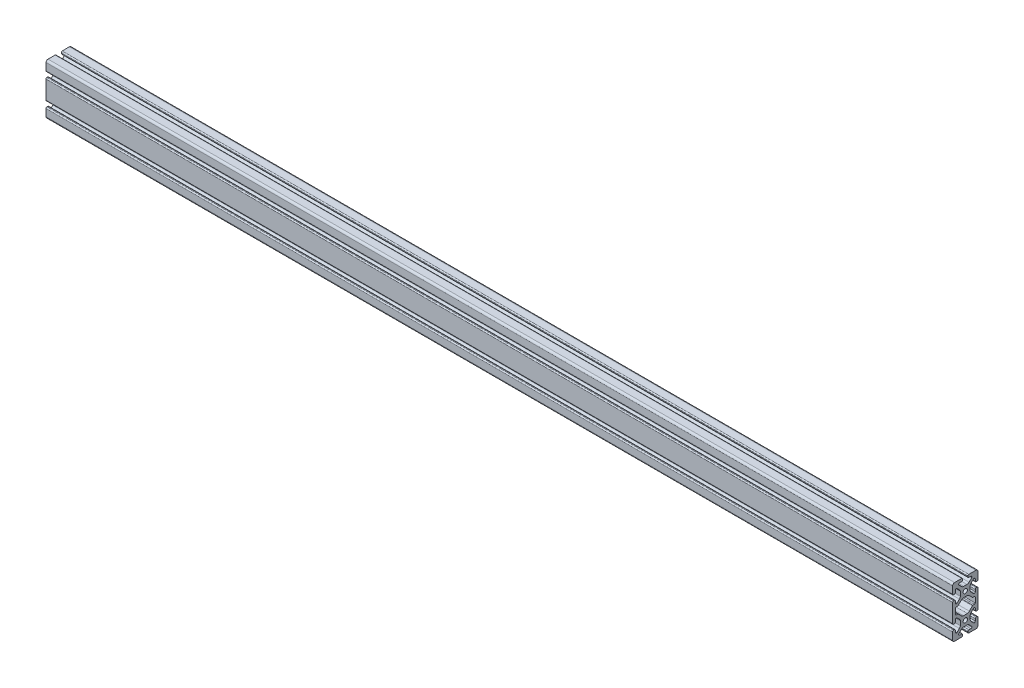
from build123d import *

# Parameters (mm, degrees)
SKETCH1_R           = 3.4
BOSS_EXTRUDE1_DEPTH = 1427


with BuildPart() as part:
    # Sketch1 → Boss-Extrude1 (new body)
    with BuildSketch(Plane(origin=(-1427, 0, 0), x_dir=(0, -1, 0), z_dir=(-1, 0, 0))):
        with BuildLine():
            Line((-0.040546524, 219.215878746), (-0.040546524, 216.131019049))
            ThreePointArc((-0.040546524, 216.131019049), (-0.500374986, 215.020894938), (-1.610499097, 214.561066475))
            Line((-1.610499097, 214.561066475), (-2.068895706, 214.561066475))
            ThreePointArc((-2.068895706, 214.561066475), (-2.359747486, 214.618920492), (-2.606319718, 214.78367479))
            Line((-2.606319718, 214.78367479), (-6.709063271, 218.886418343))
            ThreePointArc((-6.709063271, 218.886418343), (-7.692446549, 220.450804489), (-8.004484422, 222.272062035))
            Line((-8.004484422, 222.272062035), (-8.004484422, 227.345041676))
            ThreePointArc((-8.004484422, 227.345041676), (-7.731905087, 229.14130058), (-6.804896564, 230.703830818))
            Line((-6.804896564, 230.703830818), (-2.548492074, 234.960235308))
            ThreePointArc((-2.548492074, 234.960235308), (-2.301919841, 235.124989607), (-2.011068061, 235.182843623))
            Line((-2.011068061, 235.182843623), (-1.609426989, 235.182843623))
            ThreePointArc((-1.609426989, 235.182843623), (-0.478979232, 234.702312434), (-0.040546524, 233.554880903))
            Line((-0.040546524, 233.554880903), (-0.040546524, 230.470021207))
            ThreePointArc((-0.040546524, 230.470021207), (0.419281939, 229.359897096), (1.52940605, 228.900068633))
            Line((1.52940605, 228.900068633), (2.710308218, 228.900068633))
            ThreePointArc((2.710308218, 228.900068633), (3.802133235, 229.341894788), (4.279421424, 230.418690133))
            Line((4.279421424, 230.418690133), (4.279421424, 241.674714264))
            ThreePointArc((4.279421424, 241.674714264), (3.431976038, 243.839803216), (1.334940864, 244.843903476))
            Line((1.334940864, 244.843903476), (-9.921083267, 244.843903476))
            ThreePointArc((-9.921083267, 244.843903476), (-11.138847204, 244.451486057), (-11.66018156, 243.283089325))
            Line((-11.66018156, 243.283089325), (-11.66018156, 242.093048734))
            ThreePointArc((-11.66018156, 242.093048734), (-11.200353098, 240.982924623), (-10.090228987, 240.52309616))
            Line((-10.090228987, 240.52309616), (-7.00536929, 240.52309616))
            ThreePointArc((-7.00536929, 240.52309616), (-5.895245179, 240.063267698), (-5.435416717, 238.953143587))
            Line((-5.435416717, 238.953143587), (-5.435416717, 238.497474785))
            ThreePointArc((-5.435416717, 238.497474785), (-5.493270733, 238.206623006), (-5.658025031, 237.960050773))
            Line((-5.658025031, 237.960050773), (-9.410848055, 234.207227749))
            ThreePointArc((-9.410848055, 234.207227749), (-10.740696883, 233.100241429), (-12.378813581, 232.543024866))
            Line((-12.378813581, 232.543024866), (-19.061907151, 232.543024866))
            ThreePointArc((-19.061907151, 232.543024866), (-20.70002385, 233.100241429), (-22.029872677, 234.207227749))
            Line((-22.029872677, 234.207227749), (-25.782695701, 237.960050773))
            ThreePointArc((-25.782695701, 237.960050773), (-25.94745, 238.206623006), (-26.005304016, 238.497474785))
            Line((-26.005304016, 238.497474785), (-26.005304016, 238.953143587))
            ThreePointArc((-26.005304016, 238.953143587), (-25.545475553, 240.063267698), (-24.435351442, 240.52309616))
            Line((-24.435351442, 240.52309616), (-21.350491746, 240.52309616))
            ThreePointArc((-21.350491746, 240.52309616), (-20.240367635, 240.982924623), (-19.780539172, 242.093048734))
            Line((-19.780539172, 242.093048734), (-19.780539172, 243.273950903))
            ThreePointArc((-19.780539172, 243.273950903), (-20.240367635, 244.384075013), (-21.350491746, 244.843903476))
            Line((-21.350491746, 244.843903476), (-50.090170824, 244.843903476))
            ThreePointArc((-50.090170824, 244.843903476), (-51.200294934, 244.384075013), (-51.660123397, 243.273950903))
            Line((-51.660123397, 243.273950903), (-51.660123397, 242.093048734))
            ThreePointArc((-51.660123397, 242.093048734), (-51.200294934, 240.982924623), (-50.090170824, 240.52309616))
            Line((-50.090170824, 240.52309616), (-47.005311127, 240.52309616))
            ThreePointArc((-47.005311127, 240.52309616), (-45.895187016, 240.063267698), (-45.435358553, 238.953143587))
            Line((-45.435358553, 238.953143587), (-45.435358553, 238.497474785))
            ThreePointArc((-45.435358553, 238.497474785), (-45.493212569, 238.206623006), (-45.657966868, 237.960050773))
            Line((-45.657966868, 237.960050773), (-49.410789892, 234.207227749))
            ThreePointArc((-49.410789892, 234.207227749), (-50.740638719, 233.100241429), (-52.378755418, 232.543024866))
            Line((-52.378755418, 232.543024866), (-59.061848988, 232.543024866))
            ThreePointArc((-59.061848988, 232.543024866), (-60.699965686, 233.100241429), (-62.029814514, 234.207227749))
            Line((-62.029814514, 234.207227749), (-65.782637538, 237.960050773))
            ThreePointArc((-65.782637538, 237.960050773), (-65.947391836, 238.206623006), (-66.005245853, 238.497474785))
            Line((-66.005245853, 238.497474785), (-66.005245853, 238.953143587))
            ThreePointArc((-66.005245853, 238.953143587), (-65.54541739, 240.063267698), (-64.435293279, 240.52309616))
            Line((-64.435293279, 240.52309616), (-61.350433582, 240.52309616))
            ThreePointArc((-61.350433582, 240.52309616), (-60.240309471, 240.982924623), (-59.780481009, 242.093048734))
            Line((-59.780481009, 242.093048734), (-59.780481009, 243.283089325))
            ThreePointArc((-59.780481009, 243.283089325), (-60.301815367, 244.451486056), (-61.519579302, 244.843903476))
            Line((-61.519579302, 244.843903476), (-72.775603433, 244.843903476))
            ThreePointArc((-72.775603433, 244.843903476), (-74.872638606, 243.839803215), (-75.720083993, 241.674714264))
            Line((-75.720083993, 241.674714264), (-75.720083993, 230.418690133))
            ThreePointArc((-75.720083993, 230.418690133), (-75.242795814, 229.341894777), (-74.150970788, 228.900068633))
            Line((-74.150970788, 228.900068633), (-72.970068619, 228.900068633))
            ThreePointArc((-72.970068619, 228.900068633), (-71.859944508, 229.359897096), (-71.400116045, 230.470021207))
            Line((-71.400116045, 230.470021207), (-71.400116045, 233.554880903))
            ThreePointArc((-71.400116045, 233.554880903), (-70.961683339, 234.702312435), (-69.83123558, 235.182843623))
            Line((-69.83123558, 235.182843623), (-69.429594508, 235.182843623))
            ThreePointArc((-69.429594508, 235.182843623), (-69.138742728, 235.124989607), (-68.892170495, 234.960235308))
            Line((-68.892170495, 234.960235308), (-64.635766005, 230.703830818))
            ThreePointArc((-64.635766005, 230.703830818), (-63.708757482, 229.14130058), (-63.436178147, 227.345041676))
            Line((-63.436178147, 227.345041676), (-63.436178147, 222.272062035))
            ThreePointArc((-63.436178147, 222.272062035), (-63.74821602, 220.450804489), (-64.731599299, 218.886418343))
            Line((-64.731599299, 218.886418343), (-68.834342851, 214.78367479))
            ThreePointArc((-68.834342851, 214.78367479), (-69.080915084, 214.618920492), (-69.371766863, 214.561066475))
            Line((-69.371766863, 214.561066475), (-69.830163472, 214.561066475))
            ThreePointArc((-69.830163472, 214.561066475), (-70.940287583, 215.020894938), (-71.400116045, 216.131019049))
            Line((-71.400116045, 216.131019049), (-71.400116045, 219.215878746))
            ThreePointArc((-71.400116045, 219.215878746), (-71.823650113, 220.288481045), (-72.865734449, 220.78236062))
            Line((-72.865734449, 220.78236062), (-74.046636618, 220.78236062))
            ThreePointArc((-74.046636618, 220.78236062), (-75.204685564, 220.379681243), (-75.720083993, 219.267209885))
            Line((-75.720083993, 219.267209885), (-75.720083993, 208.003885317))
            ThreePointArc((-75.720083993, 208.003885317), (-74.789038907, 205.76799338), (-72.550829678, 204.842532885))
            Line((-72.550829678, 204.842532885), (-61.29006302, 204.842532885))
            ThreePointArc((-61.29006302, 204.842532885), (-60.219166593, 205.322753632), (-59.780481009, 206.411324292))
            Line((-59.780481009, 206.411324292), (-59.780481009, 207.59303372))
            ThreePointArc((-59.780481009, 207.59303372), (-60.240309471, 208.703157831), (-61.350433582, 209.162986294))
            Line((-61.350433582, 209.162986294), (-64.435293279, 209.162986294))
            ThreePointArc((-64.435293279, 209.162986294), (-65.54541739, 209.622814756), (-66.005245853, 210.732938867))
            Line((-66.005245853, 210.732938867), (-66.005245853, 211.188607669))
            ThreePointArc((-66.005245853, 211.188607669), (-65.947391836, 211.479459448), (-65.782637538, 211.726031681))
            Line((-65.782637538, 211.726031681), (-61.628433082, 215.880236136))
            ThreePointArc((-61.628433082, 215.880236136), (-60.07288474, 216.841002675), (-58.269672004, 217.143040445))
            Line((-58.269672004, 217.143040445), (-53.170932402, 217.143040445))
            ThreePointArc((-53.170932402, 217.143040445), (-51.367719666, 216.841002675), (-49.812171323, 215.880236136))
            Line((-49.812171323, 215.880236136), (-45.657966868, 211.726031681))
            ThreePointArc((-45.657966868, 211.726031681), (-45.493212569, 211.479459448), (-45.435358553, 211.188607669))
            Line((-45.435358553, 211.188607669), (-45.435358553, 210.732938867))
            ThreePointArc((-45.435358553, 210.732938867), (-45.895187016, 209.622814756), (-47.005311127, 209.162986294))
            Line((-47.005311127, 209.162986294), (-50.090170824, 209.162986294))
            ThreePointArc((-50.090170824, 209.162986294), (-51.200272703, 208.703180062), (-51.660123397, 207.593096599))
            Line((-51.660123397, 207.593096599), (-51.660123397, 206.41219443))
            ThreePointArc((-51.660123397, 206.41219443), (-51.200192055, 205.302258439), (-50.090170824, 204.842532885))
            Line((-50.090170824, 204.842532885), (-21.350491746, 204.842532885))
            ThreePointArc((-21.350491746, 204.842532885), (-20.240470534, 205.302258458), (-19.780539172, 206.41219443))
            Line((-19.780539172, 206.41219443), (-19.780539172, 207.593096599))
            ThreePointArc((-19.780539172, 207.593096599), (-20.240389865, 208.703180063), (-21.350491746, 209.162986294))
            Line((-21.350491746, 209.162986294), (-24.435351442, 209.162986294))
            ThreePointArc((-24.435351442, 209.162986294), (-25.545475553, 209.622814756), (-26.005304016, 210.732938867))
            Line((-26.005304016, 210.732938867), (-26.005304016, 211.188607669))
            ThreePointArc((-26.005304016, 211.188607669), (-25.94745, 211.479459448), (-25.782695701, 211.726031681))
            Line((-25.782695701, 211.726031681), (-21.628491246, 215.880236136))
            ThreePointArc((-21.628491246, 215.880236136), (-20.072942904, 216.841002675), (-18.269730167, 217.143040445))
            Line((-18.269730167, 217.143040445), (-13.170990565, 217.143040445))
            ThreePointArc((-13.170990565, 217.143040445), (-11.367777829, 216.841002675), (-9.812229487, 215.880236136))
            Line((-9.812229487, 215.880236136), (-5.658025031, 211.726031681))
            ThreePointArc((-5.658025031, 211.726031681), (-5.493270733, 211.479459448), (-5.435416717, 211.188607669))
            Line((-5.435416717, 211.188607669), (-5.435416717, 210.732938867))
            ThreePointArc((-5.435416717, 210.732938867), (-5.895245179, 209.622814756), (-7.00536929, 209.162986294))
            Line((-7.00536929, 209.162986294), (-10.090228987, 209.162986294))
            ThreePointArc((-10.090228987, 209.162986294), (-11.200353098, 208.703157831), (-11.66018156, 207.59303372))
            Line((-11.66018156, 207.59303372), (-11.66018156, 206.411324292))
            ThreePointArc((-11.66018156, 206.411324292), (-11.221495976, 205.322753632), (-10.150599549, 204.842532885))
            Line((-10.150599549, 204.842532885), (1.110167109, 204.842532885))
            ThreePointArc((1.110167109, 204.842532885), (3.348376327, 205.767993391), (4.279421424, 208.003885317))
            Line((4.279421424, 208.003885317), (4.279421424, 219.267209885))
            ThreePointArc((4.279421424, 219.267209885), (3.764023007, 220.379681255), (2.605974049, 220.78236062))
            Line((2.605974049, 220.78236062), (1.42507188, 220.78236062))
            ThreePointArc((1.42507188, 220.78236062), (0.382987544, 220.288481045), (-0.040546524, 219.215878746))
        make_face()
        with Locations(Location((-55.720335876, 224.843028529, 0), (0, 0, 90))):
            Circle(SKETCH1_R, mode=Mode.SUBTRACT)
        with Locations(Location((-15.720335876, 224.843028529, 0), (0, 0, 90))):
            Circle(SKETCH1_R, mode=Mode.SUBTRACT)
        with BuildLine():
            Line((-41.062079606, 210.433009826), (-41.062079606, 212.71343187))
            ThreePointArc((-41.062079606, 212.71343187), (-41.158754391, 213.199448834), (-41.434060886, 213.611474122))
            Line((-41.434060886, 213.611474122), (-46.319102867, 218.496516102))
            ThreePointArc((-46.319102867, 218.496516102), (-47.458104456, 219.878474881), (-48.004469209, 221.58394263))
            Line((-48.004469209, 221.58394263), (-48.004469209, 227.568001073))
            ThreePointArc((-48.004469209, 227.568001073), (-47.725538926, 229.171757783), (-46.921506857, 230.587162361))
            Line((-46.921506857, 230.587162361), (-41.434060886, 236.074608332))
            ThreePointArc((-41.434060886, 236.074608332), (-41.158754391, 236.48663362), (-41.062079606, 236.972650584))
            Line((-41.062079606, 236.972650584), (-41.062079606, 239.253072628))
            ThreePointArc((-41.062079606, 239.253072628), (-40.690098326, 240.15111488), (-39.792056074, 240.52309616))
            Line((-39.792056074, 240.52309616), (-31.648606495, 240.52309616))
            ThreePointArc((-31.648606495, 240.52309616), (-30.750564243, 240.15111488), (-30.378582963, 239.253072628))
            Line((-30.378582963, 239.253072628), (-30.378582963, 236.972650584))
            ThreePointArc((-30.378582963, 236.972650584), (-30.281908178, 236.48663362), (-30.006601683, 236.074608332))
            Line((-30.006601683, 236.074608332), (-24.519155712, 230.587162361))
            ThreePointArc((-24.519155712, 230.587162361), (-23.715123643, 229.171757783), (-23.43619336, 227.568001073))
            Line((-23.43619336, 227.568001073), (-23.43619336, 221.58394263))
            ThreePointArc((-23.43619336, 221.58394263), (-23.982558114, 219.878474881), (-25.121559702, 218.496516102))
            Line((-25.121559702, 218.496516102), (-30.006601683, 213.611474122))
            ThreePointArc((-30.006601683, 213.611474122), (-30.281908178, 213.199448834), (-30.378582963, 212.71343187))
            Line((-30.378582963, 212.71343187), (-30.378582963, 210.433009826))
            ThreePointArc((-30.378582963, 210.433009826), (-30.750564243, 209.534967574), (-31.648606495, 209.162986294))
            Line((-31.648606495, 209.162986294), (-39.792056074, 209.162986294))
            ThreePointArc((-39.792056074, 209.162986294), (-40.690098326, 209.534967574), (-41.062079606, 210.433009826))
        make_face(mode=Mode.SUBTRACT)
    extrude(amount=-BOSS_EXTRUDE1_DEPTH)


solid = part.part
